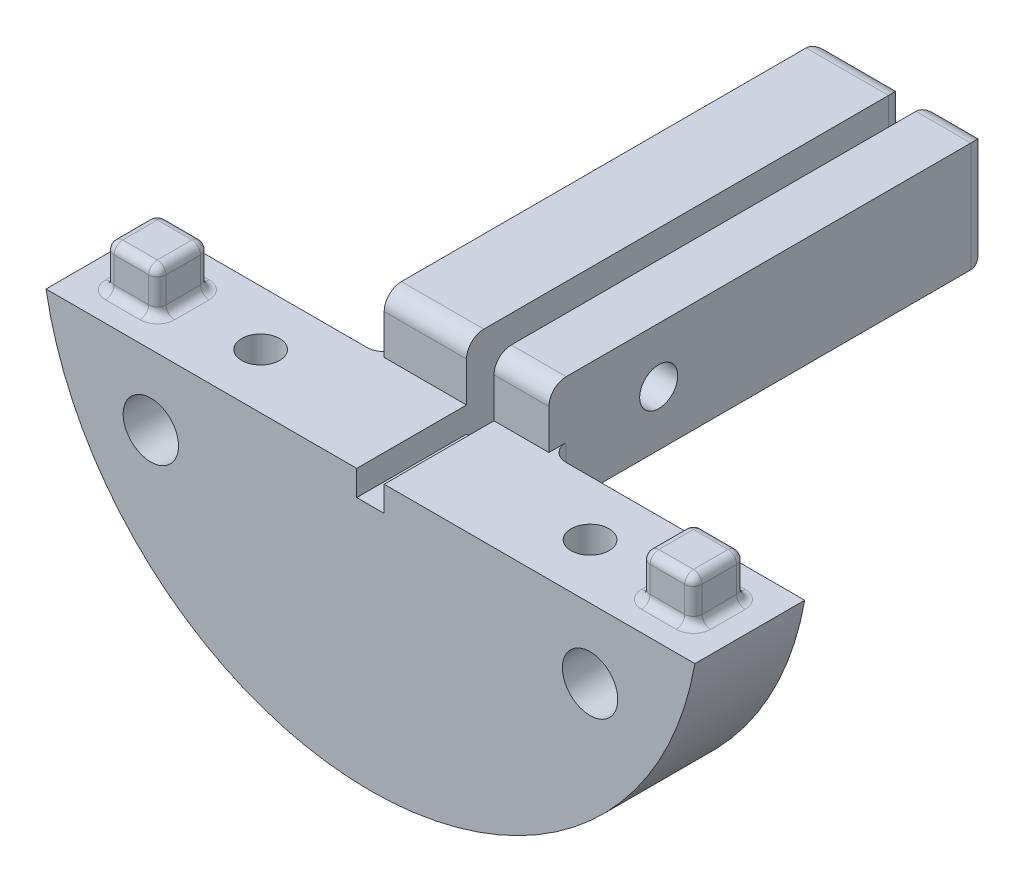
from build123d import *

# Parameters (mm, degrees)
SKETCH1_R                     = 19.05
SKETCH1_R_2                   = 0.5
BOSS_EXTRUDE1_DEPTH           = 6.35
M3_CLEARANCE_HOLE1_D          = 3.2
M3_CLEARANCE_HOLE1_DEPTH      = 29.72
M3_CLEARANCE_HOLE1_TIP        = 0.96137699
SKETCH4_W                     = 37.608509676
SKETCH4_H                     = 0.25
CUT_EXTRUDE1_DEPTH            = 28.679008291
CBORE_FOR_M2_SHCS1_AT_2_COUNT = 2
CBORE_FOR_M2_SHCS1_AT_2_PITCH = 19.05
CUT_EXTRUDE2_DEPTH            = 10
FILLET1_R                     = 2.38125
SKETCH12_W                    = 55.779861043
SKETCH12_H                    = 27.835929003
CUT_EXTRUDE3_DEPTH            = 28.679008452
SKETCH13_W                    = 3
SKETCH13_H                    = 3
BOSS_EXTRUDE2_DEPTH           = 2.5
FILLET2_R                     = 0.5
SKETCH14_W                    = 1.5875
SKETCH14_H                    = 1.4625
CUT_EXTRUDE4_DEPTH            = 28.481584743
SKETCH15_W                    = 3.175
SKETCH15_H                    = 6.35
SKETCH15_W_2                  = 4.7625
BOSS_EXTRUDE3_DEPTH           = 25.4
M2_CLEARANCE_HOLE1_D          = 2.2
M2_CLEARANCE_HOLE1_DEPTH      = 28.35
M2_CLEARANCE_HOLE1_TIP        = 0.660946681
CUT_EXTRUDE5_DEPTH            = 2.5
FILLET3_R                     = 1
FILLET4_R                     = 1


with BuildPart() as part:
    # Sketch1 → Boss-Extrude1 (new body)
    with BuildSketch(Plane.XY):
        Circle(SKETCH1_R)
        with Locations((-12.7, 0)):
            Circle(SKETCH1_R_2, mode=Mode.SUBTRACT)
        with Locations((12.7, 0)):
            Circle(SKETCH1_R_2, mode=Mode.SUBTRACT)
        Circle(SKETCH1_R_2, mode=Mode.SUBTRACT)
    extrude(amount=BOSS_EXTRUDE1_DEPTH)

    # M3 Clearance Hole1
    with Locations(Plane(origin=(-15.665967818, 20.219646462, 6.35), x_dir=(1, 0, 0), z_dir=(0, 0, 1))):
        with Locations((15.665967818, -5.554949625), (2.965967818, -27.551994881), (28.365967818, -27.551994881)):
            Hole(M3_CLEARANCE_HOLE1_D / 2, depth=M3_CLEARANCE_HOLE1_DEPTH)
            with Locations((0, 0, -(M3_CLEARANCE_HOLE1_DEPTH + M3_CLEARANCE_HOLE1_TIP / 2))):  # 118° drill point
                Cone(0, M3_CLEARANCE_HOLE1_D / 2, M3_CLEARANCE_HOLE1_TIP, mode=Mode.SUBTRACT)

    # Sketch4 → Cut-Extrude1 (cut, through all)
    with BuildSketch(Plane(origin=(0, 0, 0), x_dir=(-1, 0, 0), z_dir=(0, 0, -1))):
        with Locations((0, -3.175)):
            Rectangle(SKETCH4_W, SKETCH4_H)
    extrude(amount=-CUT_EXTRUDE1_DEPTH, mode=Mode.SUBTRACT)


with BuildPart() as cut_extrude1_piece_1:
    # of the separate pieces the step leaves, piece 1, a body of its own (cut_extrude1_pieces)
    add(part.part.solids().sort_by_distance((18.804254838, -3.05, 0))[0])


with BuildPart() as cut_extrude1_piece_2:
    # of the separate pieces the step leaves, piece 2, a body of its own (cut_extrude1_pieces)
    add(part.part.solids().sort_by_distance((-18.761996162, -3.3, 0))[0])


with BuildPart() as cbore_for_m2_shcs1_tool:
    # Sketch9 → CBORE for M2 SHCS1 (revolve)
    with BuildSketch(Plane(origin=(-9.525, 19.05, 3.175), x_dir=(0, 0, 1), z_dir=(1, 0, 0))):
        Polygon((0, 0), (0, 38.1), (1.1, 38.1), (1.1, 2), (2.2, 2), (2.2, 0), align=None)
    cbore_for_m2_shcs1 = revolve(axis=Axis((-9.525, 25.4, 3.175), (0, -1, 0)))


with BuildPart() as cut_extrude1_piece_1_1:
    add(cut_extrude1_piece_1.part)

    # CBORE for M2 SHCS1: cut by cbore_for_m2_shcs1_tool
    add(cbore_for_m2_shcs1_tool.part, mode=Mode.SUBTRACT)


with BuildPart() as cut_extrude1_piece_2_1:
    add(cut_extrude1_piece_2.part)

    # CBORE for M2 SHCS1: cut by cbore_for_m2_shcs1_tool
    add(cbore_for_m2_shcs1_tool.part, mode=Mode.SUBTRACT)


with BuildPart() as cbore_for_m2_shcs1_at_2_tool:
    # CBORE for M2 SHCS1 at 2: CBORE for M2 SHCS1 ×2
    with Locations(*[(i * CBORE_FOR_M2_SHCS1_AT_2_PITCH, 0, 0) for i in range(1, CBORE_FOR_M2_SHCS1_AT_2_COUNT)]):
        add(cbore_for_m2_shcs1)


with BuildPart() as cut_extrude1_piece_1_2:
    add(cut_extrude1_piece_1_1.part)

    # CBORE for M2 SHCS1 at 2: cut by cbore_for_m2_shcs1_at_2_tool
    add(cbore_for_m2_shcs1_at_2_tool.part, mode=Mode.SUBTRACT)

    # Fillet1
    fillet1_edges = [cut_extrude1_piece_1_2.edges().sort_by_distance(p)[0] for p in [
        (-0.5, 0, 0),
        (-13.2, 0, 0),
        (12.2, 0, 0),
        (-13.2, 0, 6.35),
        (12.2, 0, 6.35),
        (-0.5, 0, 6.35),
    ]]
    fillet(fillet1_edges, radius=FILLET1_R)

    # Sketch12 → Cut-Extrude3 (cut, through all)
    with BuildSketch(Plane.XY):
        with Locations((0.042756797, 10.867964502)):
            Rectangle(SKETCH12_W, SKETCH12_H)
    extrude(amount=CUT_EXTRUDE3_DEPTH, mode=Mode.SUBTRACT)


with BuildPart() as cut_extrude1_piece_2_2:
    add(cut_extrude1_piece_2_1.part)

    # CBORE for M2 SHCS1 at 2: cut by cbore_for_m2_shcs1_at_2_tool
    add(cbore_for_m2_shcs1_at_2_tool.part, mode=Mode.SUBTRACT)

    # Sketch11 → Cut-Extrude2 (cut)
    with BuildSketch(Plane.XZ.offset(19.05)):
        Polygon((-10.679700538, 5.175), (-11.834401077, 3.175), (-10.679700538, 1.175), (-8.370299462, 1.175), (-7.215598923, 3.175), (-8.370299462, 5.175), align=None)
        Polygon((8.370299462, 5.175), (7.215598923, 3.175), (8.370299462, 1.175), (10.679700538, 1.175), (11.834401077, 3.175), (10.679700538, 5.175), align=None)
    extrude(amount=-CUT_EXTRUDE2_DEPTH, mode=Mode.SUBTRACT)

    # Sketch13 → Boss-Extrude2 (add)
    with BuildSketch(Plane(origin=(0, -3.3, 0), x_dir=(1, 0, 0), z_dir=(0, 1, 0))):
        with Locations((-15.5, -3.175)):
            Rectangle(SKETCH13_W, SKETCH13_H)
        with Locations((15.5, -3.175)):
            Rectangle(SKETCH13_W, SKETCH13_H)
    extrude(amount=BOSS_EXTRUDE2_DEPTH)

    # Fillet2
    fillet2_edges = [cut_extrude1_piece_2_2.edges().sort_by_distance(p)[0] for p in [
        (17, -3.3, 3.175),
        (17, -2.05, 4.675),
        (15.5, -3.3, 1.675),
        (17, -2.05, 1.675),
        (14, -3.3, 3.175),
        (14, -2.05, 1.675),
        (15.5, -3.3, 4.675),
        (14, -2.05, 4.675),
        (17, -0.8, 3.175),
        (15.5, -0.8, 1.675),
        (14, -0.8, 3.175),
        (15.5, -0.8, 4.675),
        (-15.5, -3.3, 1.675),
        (-14, -2.05, 1.675),
        (-17, -3.3, 3.175),
        (-17, -2.05, 1.675),
        (-15.5, -3.3, 4.675),
        (-17, -2.05, 4.675),
        (-14, -3.3, 3.175),
        (-14, -2.05, 4.675),
        (-15.5, -0.8, 1.675),
        (-17, -0.8, 3.175),
        (-15.5, -0.8, 4.675),
        (-14, -0.8, 3.175),
    ]]
    fillet(fillet2_edges, radius=FILLET2_R)

    # Sketch14 → Cut-Extrude4 (cut, through all)
    with BuildSketch(Plane(origin=(0, 0, 0), x_dir=(-1, 0, 0), z_dir=(0, 0, -1))):
        with Locations((0, -4.03125)):
            Rectangle(SKETCH14_W, SKETCH14_H)
    extrude(amount=-CUT_EXTRUDE4_DEPTH, mode=Mode.SUBTRACT)

    # Sketch15 → Boss-Extrude3 (add)
    with BuildSketch(Plane(origin=(0, 0, 0), x_dir=(-1, 0, 0), z_dir=(0, 0, -1))):
        with Locations((-2.38125, -3.175)):
            Rectangle(SKETCH15_W, SKETCH15_H)
        with Locations((3.175, -3.175)):
            Rectangle(SKETCH15_W_2, SKETCH15_H)
    extrude(amount=BOSS_EXTRUDE3_DEPTH)

    # M2 Clearance Hole1
    with Locations(Plane.ZY.offset(5.55625)):
        with Locations((-6.35, -3.175)):
            Hole(M2_CLEARANCE_HOLE1_D / 2, depth=M2_CLEARANCE_HOLE1_DEPTH)
            with Locations((0, 0, -(M2_CLEARANCE_HOLE1_DEPTH + M2_CLEARANCE_HOLE1_TIP / 2))):  # 118° drill point
                Cone(0, M2_CLEARANCE_HOLE1_D / 2, M2_CLEARANCE_HOLE1_TIP, mode=Mode.SUBTRACT)

    # Sketch18 → Cut-Extrude5 (cut)
    with BuildSketch(Plane.ZY.offset(5.55625)):
        Polygon((-7.504700538, -1.175), (-5.195299462, -1.175), (-4.040598923, -3.175), (-5.195299462, -5.175), (-7.504700538, -5.175), (-8.659401077, -3.175), align=None)
    extrude(amount=-CUT_EXTRUDE5_DEPTH, mode=Mode.SUBTRACT)

    # Fillet3
    fillet3_edges = [cut_extrude1_piece_2_2.edges().sort_by_distance(p)[0] for p in [
        (3.96875, -4.825, 0),
        (2.38125, -6.35, 0),
        (0.79375, -3.175, -25.4),
        (2.38125, 0, -25.4),
        (3.96875, -3.175, -25.4),
        (2.38125, -6.35, -25.4),
        (-3.175, -6.35, 0),
        (-5.55625, -4.825, 0),
        (-0.79375, -3.175, -25.4),
        (-3.175, -6.35, -25.4),
        (-5.55625, -3.175, -25.4),
        (-3.175, 0, -25.4),
    ]]
    fillet(fillet3_edges, radius=FILLET3_R)

    # Fillet4
    fillet4_edges = [cut_extrude1_piece_2_2.edges().sort_by_distance(p)[0] for p in [
        (2.38125, 0, 0),
        (-3.175, 0, 0),
    ]]
    fillet(fillet4_edges, radius=FILLET4_R)


solid = cut_extrude1_piece_2_2.part
